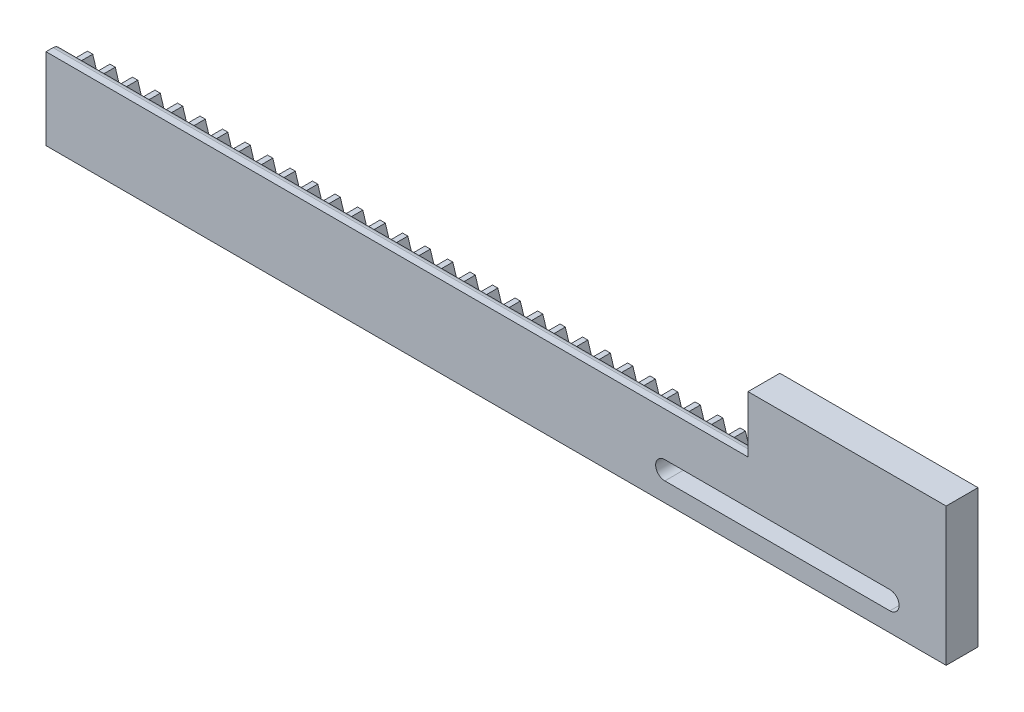
from build123d import *

# Parameters (mm, degrees)
BOSS_EXTRUDE3_DEPTH             = 127.2
CUT_EXTRUDE1_DEPTH              = 128.798043803
BOSS_EXTRUDE5_REACH             = 129.798
LPATTERN3_COUNT                 = 30
LPATTERN3_PITCH                 = 3.18
LPATTERN3_COL_COUNT             = 11
LPATTERN3_COL_PITCH             = 3.18
FILLET2_R                       = 1
SKETCH9_W                       = 28
SKETCH9_H                       = 4.5
BOSS_EXTRUDE6_DEPTH             = 8
BOSS_EXTRUDE6_DIRECTION_2_REACH = 129.798


with BuildPart() as part:
    # Sketch4 → Boss-Extrude3 (new body)
    with BuildSketch(Plane(origin=(0, 0, 0), x_dir=(0, 0, -1), z_dir=(1, 0, 0))):
        Polygon((0, 0), (-4.5, 0), (-4.5, 11.5), (-2.5, 11.5), (-2.5, 8), (0, 8), align=None)
    extrude(amount=BOSS_EXTRUDE3_DEPTH)

    # Sketch6 → Cut-Extrude1 (cut, through all)
    with BuildSketch(Plane.XY.offset(4.5)):
        with BuildLine():
            Line((87.45, 5.3), (119.25, 5.3))
            ThreePointArc((119.25, 5.3), (120.55, 4), (119.25, 2.7))
            Line((119.25, 2.7), (87.45, 2.7))
            ThreePointArc((87.45, 2.7), (86.15, 4), (87.45, 5.3))
        make_face()
    extrude(amount=-CUT_EXTRUDE1_DEPTH, mode=Mode.SUBTRACT)

    # Sketch8 → Boss-Extrude5 (add, up to next)
    with BuildSketch(Plane(origin=(0, 0, 0), x_dir=(-1, 0, 0), z_dir=(0, 0, -1)), mode=Mode.PRIVATE) as boss_extrude5_sk1:
        Polygon((-94.952664599, 8), (-94.327664599, 10), (-93.577664599, 10), (-92.952664599, 8), align=None)
    boss_extrude5_tool1 = extrude(boss_extrude5_sk1.sketch, amount=-BOSS_EXTRUDE5_REACH, mode=Mode.PRIVATE) - part.part
    boss_extrude5 = boss_extrude5_tool1.solids().sort_by_distance((93.952665, 8.848485, 0))[0]
    add(boss_extrude5)

    # LPattern3: Boss-Extrude5 ×30
    with Locations(*[(-i * LPATTERN3_PITCH, 0, 0) for i in range(1, LPATTERN3_COUNT)]):
        add(boss_extrude5)

    # LPattern3 col: Boss-Extrude5 ×11
    with Locations(*[(i * LPATTERN3_COL_PITCH, 0, 0) for i in range(1, LPATTERN3_COL_COUNT)]):
        add(boss_extrude5)

    # Fillet2
    fillet2_edges = [part.edges().sort_by_distance(p)[0] for p in [
        (63.6, 11.5, 2.5),
    ]]
    fillet(fillet2_edges, radius=FILLET2_R)

    # Sketch9 → Boss-Extrude6 (add)
    with BuildSketch(Plane(origin=(0, 11.5, 0), x_dir=(1, 0, 0), z_dir=(0, 1, 0))):
        with Locations((113.2, -2.25)):
            Rectangle(SKETCH9_W, SKETCH9_H)
    extrude(amount=BOSS_EXTRUDE6_DEPTH)

    # Sketch9 → Boss-Extrude6 direction 2 (add, up to next)
    with BuildSketch(Plane(origin=(0, 11.5, 0), x_dir=(1, 0, 0), z_dir=(0, 1, 0)), mode=Mode.PRIVATE) as boss_extrude6_direction_2_sk1:
        with Locations((113.2, -2.25)):
            Rectangle(SKETCH9_W, SKETCH9_H)
    boss_extrude6_direction_2_tool1 = extrude(boss_extrude6_direction_2_sk1.sketch, amount=-BOSS_EXTRUDE6_DIRECTION_2_REACH, mode=Mode.PRIVATE) - part.part
    add(boss_extrude6_direction_2_tool1.solids().sort_by_distance((113.2, 11.5, 2.25))[0])


solid = part.part
